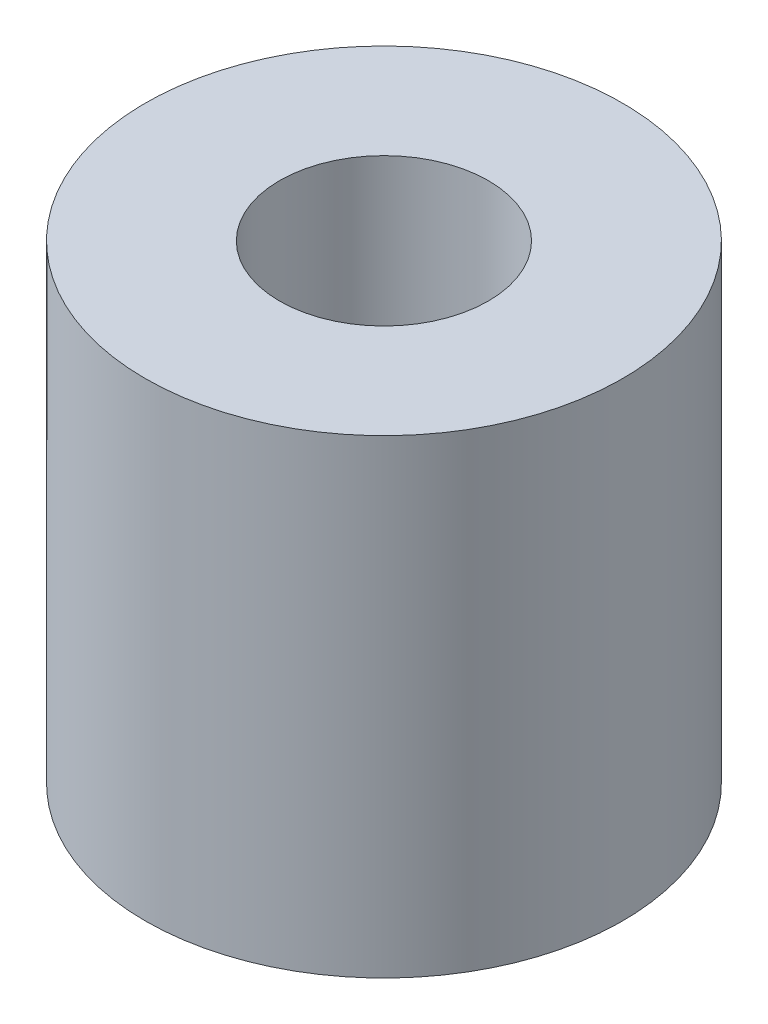
from build123d import *

# Parameters (mm, degrees)
SKETCH1_R           = 4.572
SKETCH1_R_2         = 2
BOSS_EXTRUDE1_DEPTH = 9


with BuildPart() as part:
    # Sketch1 → Boss-Extrude1 (new body)
    with BuildSketch(Plane(origin=(0, 0, 0), x_dir=(1, 0, 0), z_dir=(0, 1, 0))):
        with Locations(Location((0, 0, 0), (0, 0, 270))):
            Circle(SKETCH1_R)
        with Locations(Location((0, 0, 0), (0, 0, 270))):
            Circle(SKETCH1_R_2, mode=Mode.SUBTRACT)
    extrude(amount=BOSS_EXTRUDE1_DEPTH)


solid = part.part
